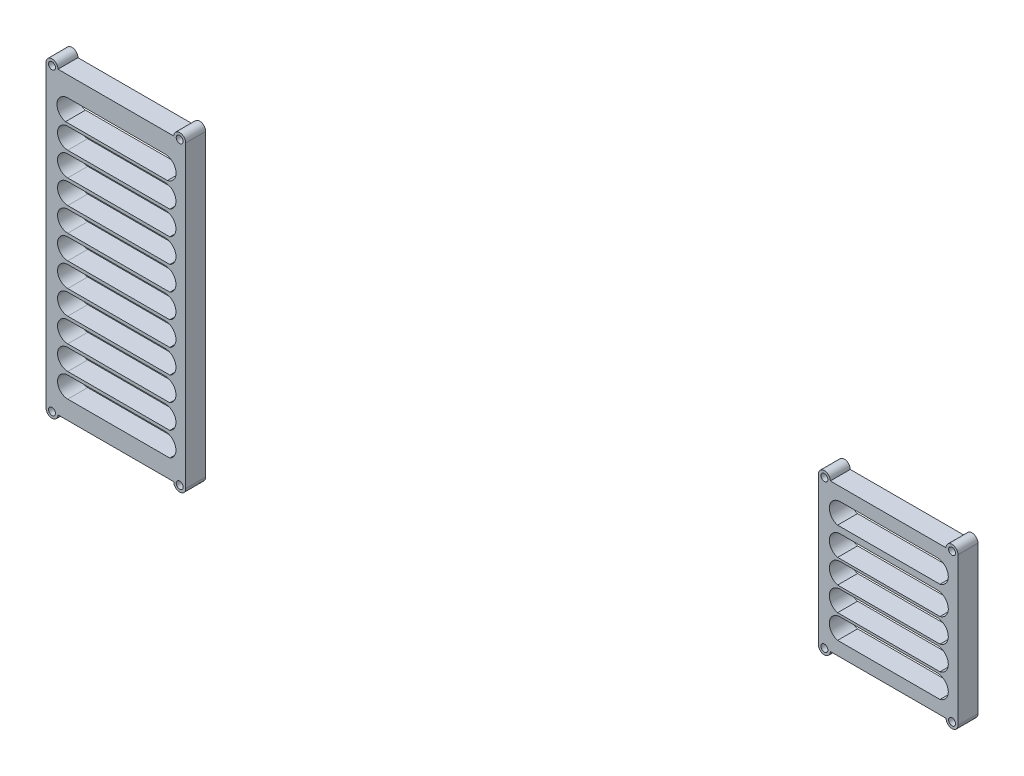
from build123d import *

# Parameters (mm, degrees)
SKETCH1_R             = 0.875
BOSS_EXTRUDE2_DEPTH   = 5
BOSS_EXTRUDE2_2_DEPTH = 5


with BuildPart() as part:
    # Sketch1 → Boss-Extrude2 (new body)
    with BuildSketch(Plane.XY):
        with BuildLine():
            Line((-51.180838319, 47.12245603), (-22.180838319, 47.12245603))
            ThreePointArc((-22.180838319, 47.12245603), (-20.680838319, 48.62245603), (-19.180838319, 47.12245603))
            Line((-19.180838319, 47.12245603), (-19.180838319, -27.87754397))
            ThreePointArc((-19.180838319, -27.87754397), (-20.680838319, -29.37754397), (-22.180838319, -27.87754397))
            Line((-22.180838319, -27.87754397), (-51.180838319, -27.87754397))
            ThreePointArc((-51.180838319, -27.87754397), (-52.680838319, -29.37754397), (-54.180838319, -27.87754397))
            Line((-54.180838319, -27.87754397), (-54.180838319, 47.12245603))
            ThreePointArc((-54.180838319, 47.12245603), (-52.680838319, 48.62245603), (-51.180838319, 47.12245603))
        make_face()
        with Locations((-20.680838319, -27.87754397)):
            Circle(SKETCH1_R, mode=Mode.SUBTRACT)
        with Locations((-52.680838319, -27.87754397)):
            Circle(SKETCH1_R, mode=Mode.SUBTRACT)
        with Locations((-20.680838319, 47.12245603)):
            Circle(SKETCH1_R, mode=Mode.SUBTRACT)
        with Locations((-52.680838319, 47.12245603)):
            Circle(SKETCH1_R, mode=Mode.SUBTRACT)
        with BuildLine():
            Line((-48.680838319, 35.981203595), (-24.373903693, 35.981203595))
            ThreePointArc((-24.373903693, 35.981203595), (-21.695583243, 33.854982115), (-23.158864594, 30.764185147))
            Line((-23.158864594, 30.764185147), (-48.730706654, 30.764185147))
            ThreePointArc((-48.730706654, 30.764185147), (-51.289466711, 33.397391337), (-48.680838319, 35.981203595))
        make_face(mode=Mode.SUBTRACT)
        with BuildLine():
            Line((-48.680838319, 42.12245603), (-24.342140097, 42.12245603))
            ThreePointArc((-24.342140097, 42.12245603), (-21.609257107, 39.678806426), (-23.73325298, 36.690710987))
            Line((-23.73325298, 36.690710987), (-49.289725436, 36.690710987))
            ThreePointArc((-49.289725436, 36.690710987), (-51.413721309, 39.678806426), (-48.680838319, 42.12245603))
        make_face(mode=Mode.SUBTRACT)
        with BuildLine():
            Line((-48.680838319, 29.981203595), (-24.373903693, 29.981203595))
            ThreePointArc((-24.373903693, 29.981203595), (-21.695583243, 27.854982115), (-23.158864594, 24.764185147))
            Line((-23.158864594, 24.764185147), (-48.730706654, 24.764185147))
            ThreePointArc((-48.730706654, 24.764185147), (-51.289466711, 27.397391337), (-48.680838319, 29.981203595))
        make_face(mode=Mode.SUBTRACT)
        with BuildLine():
            Line((-48.680838319, 23.981203595), (-24.373903693, 23.981203595))
            ThreePointArc((-24.373903693, 23.981203595), (-21.695583243, 21.854982115), (-23.158864594, 18.764185147))
            Line((-23.158864594, 18.764185147), (-48.730706654, 18.764185147))
            ThreePointArc((-48.730706654, 18.764185147), (-51.289466711, 21.397391337), (-48.680838319, 23.981203595))
        make_face(mode=Mode.SUBTRACT)
        with BuildLine():
            Line((-48.680838319, 17.981203595), (-24.373903693, 17.981203595))
            ThreePointArc((-24.373903693, 17.981203595), (-21.695583243, 15.854982115), (-23.158864594, 12.764185147))
            Line((-23.158864594, 12.764185147), (-48.730706654, 12.764185147))
            ThreePointArc((-48.730706654, 12.764185147), (-51.289466711, 15.397391337), (-48.680838319, 17.981203595))
        make_face(mode=Mode.SUBTRACT)
        with BuildLine():
            Line((-48.680838319, 11.981203595), (-24.373903693, 11.981203595))
            ThreePointArc((-24.373903693, 11.981203595), (-21.695583243, 9.854982115), (-23.158864594, 6.764185147))
            Line((-23.158864594, 6.764185147), (-48.730706654, 6.764185147))
            ThreePointArc((-48.730706654, 6.764185147), (-51.289466711, 9.397391337), (-48.680838319, 11.981203595))
        make_face(mode=Mode.SUBTRACT)
        with BuildLine():
            Line((-48.680838319, 5.981203595), (-24.373903693, 5.981203595))
            ThreePointArc((-24.373903693, 5.981203595), (-21.695583243, 3.854982115), (-23.158864594, 0.764185147))
            Line((-23.158864594, 0.764185147), (-48.730706654, 0.764185147))
            ThreePointArc((-48.730706654, 0.764185147), (-51.289466711, 3.397391337), (-48.680838319, 5.981203595))
        make_face(mode=Mode.SUBTRACT)
        with BuildLine():
            Line((-48.680838319, -0.018796405), (-24.373903693, -0.018796405))
            ThreePointArc((-24.373903693, -0.018796405), (-21.695583243, -2.145017885), (-23.158864594, -5.235814853))
            Line((-23.158864594, -5.235814853), (-48.730706654, -5.235814853))
            ThreePointArc((-48.730706654, -5.235814853), (-51.289466711, -2.602608663), (-48.680838319, -0.018796405))
        make_face(mode=Mode.SUBTRACT)
        with BuildLine():
            Line((-48.680838319, -6.018796405), (-24.373903693, -6.018796405))
            ThreePointArc((-24.373903693, -6.018796405), (-21.695583243, -8.145017885), (-23.158864594, -11.235814853))
            Line((-23.158864594, -11.235814853), (-48.730706654, -11.235814853))
            ThreePointArc((-48.730706654, -11.235814853), (-51.289466711, -8.602608663), (-48.680838319, -6.018796405))
        make_face(mode=Mode.SUBTRACT)
        with BuildLine():
            Line((-48.680838319, -12.018796405), (-24.373903693, -12.018796405))
            ThreePointArc((-24.373903693, -12.018796405), (-21.695583243, -14.145017885), (-23.158864594, -17.235814853))
            Line((-23.158864594, -17.235814853), (-48.730706654, -17.235814853))
            ThreePointArc((-48.730706654, -17.235814853), (-51.289466711, -14.602608663), (-48.680838319, -12.018796405))
        make_face(mode=Mode.SUBTRACT)
        with BuildLine():
            Line((-48.683701898, -18.018796405), (-24.376767271, -18.018796405))
            ThreePointArc((-24.376767271, -18.018796405), (-21.698446821, -20.145017885), (-23.161728173, -23.235814853))
            Line((-23.161728173, -23.235814853), (-48.733570233, -23.235814853))
            ThreePointArc((-48.733570233, -23.235814853), (-51.292330289, -20.602608663), (-48.683701898, -18.018796405))
        make_face(mode=Mode.SUBTRACT)
    extrude(amount=BOSS_EXTRUDE2_DEPTH)


with BuildPart() as body_2:
    # Sketch1 → Boss-Extrude2 2 (new body)
    with BuildSketch(Plane.XY):
        with BuildLine():
            Line((142.319161681, 54.53186273), (171.319161681, 54.53186273))
            ThreePointArc((171.319161681, 54.53186273), (172.819161681, 56.03186273), (174.319161681, 54.53186273))
            Line((174.319161681, 54.53186273), (174.319161681, 17.53186273))
            ThreePointArc((174.319161681, 17.53186273), (172.819161681, 16.03186273), (171.319161681, 17.53186273))
            Line((171.319161681, 17.53186273), (142.319161681, 17.53186273))
            ThreePointArc((142.319161681, 17.53186273), (140.819161681, 16.03186273), (139.319161681, 17.53186273))
            Line((139.319161681, 17.53186273), (139.319161681, 54.53186273))
            ThreePointArc((139.319161681, 54.53186273), (140.819161681, 56.03186273), (142.319161681, 54.53186273))
        make_face()
        with Locations((140.819161681, 54.53186273)):
            Circle(SKETCH1_R, mode=Mode.SUBTRACT)
        with Locations((172.819161681, 54.53186273)):
            Circle(SKETCH1_R, mode=Mode.SUBTRACT)
        with Locations((172.819161681, 17.53186273)):
            Circle(SKETCH1_R, mode=Mode.SUBTRACT)
        with Locations((140.819161681, 17.53186273)):
            Circle(SKETCH1_R, mode=Mode.SUBTRACT)
        with BuildLine():
            Line((144.819161681, 51.28186273), (169.126096307, 51.28186273))
            ThreePointArc((169.126096307, 51.28186273), (171.85514793, 48.870650632), (169.798510615, 45.865337088))
            Line((169.798510615, 45.865337088), (144.146747373, 45.865337088))
            ThreePointArc((144.146747373, 45.865337088), (142.090110058, 48.870650632), (144.819161681, 51.28186273))
        make_face(mode=Mode.SUBTRACT)
        with BuildLine():
            Line((144.819161681, 44.28186273), (169.126096307, 44.28186273))
            ThreePointArc((169.126096307, 44.28186273), (171.85514793, 41.870650632), (169.798510615, 38.865337088))
            Line((169.798510615, 38.865337088), (144.146747373, 38.865337088))
            ThreePointArc((144.146747373, 38.865337088), (142.090110058, 41.870650632), (144.819161681, 44.28186273))
        make_face(mode=Mode.SUBTRACT)
        with BuildLine():
            Line((144.819161681, 38.28186273), (169.126096307, 38.28186273))
            ThreePointArc((169.126096307, 38.28186273), (171.85514793, 35.870650632), (169.798510615, 32.865337088))
            Line((169.798510615, 32.865337088), (144.146747373, 32.865337088))
            ThreePointArc((144.146747373, 32.865337088), (142.090110058, 35.870650632), (144.819161681, 38.28186273))
        make_face(mode=Mode.SUBTRACT)
        with BuildLine():
            Line((144.819161681, 32.28186273), (169.126096307, 32.28186273))
            ThreePointArc((169.126096307, 32.28186273), (171.85514793, 29.870650632), (169.798510615, 26.865337088))
            Line((169.798510615, 26.865337088), (144.146747373, 26.865337088))
            ThreePointArc((144.146747373, 26.865337088), (142.090110058, 29.870650632), (144.819161681, 32.28186273))
        make_face(mode=Mode.SUBTRACT)
        with BuildLine():
            Line((144.819161681, 26.28186273), (169.126096307, 26.28186273))
            ThreePointArc((169.126096307, 26.28186273), (171.85514793, 23.870650632), (169.798510615, 20.865337088))
            Line((169.798510615, 20.865337088), (144.146747373, 20.865337088))
            ThreePointArc((144.146747373, 20.865337088), (142.090110058, 23.870650632), (144.819161681, 26.28186273))
        make_face(mode=Mode.SUBTRACT)
    extrude(amount=BOSS_EXTRUDE2_2_DEPTH)


solid = Compound([part.part, body_2.part])
